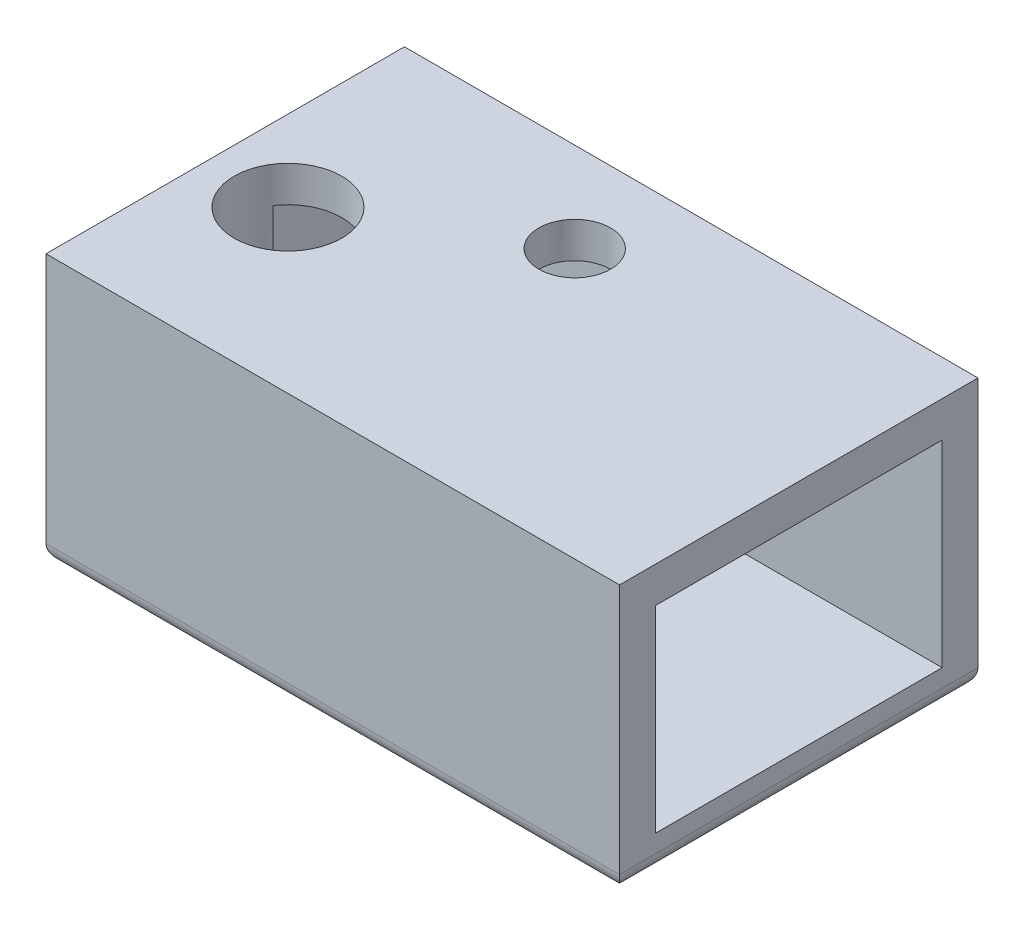
from build123d import *

# Parameters (mm, degrees)
SKETCH1_W           = 30
SKETCH1_H           = 16
BOSS_EXTRUDE1_DEPTH = 11
SHELL1_T            = 2
CUT_EXTRUDE3_REACH  = 26.779
SKETCH4_R           = 3
SKETCH4_R_2         = 2
FILLET1_R           = 1


with BuildPart() as part:
    # Sketch1 → Boss-Extrude1 (new body)
    with BuildSketch(Plane(origin=(0, 0, 0), x_dir=(1, 0, 0), z_dir=(0, 1, 0))):
        Rectangle(SKETCH1_W, SKETCH1_H)
    extrude(amount=BOSS_EXTRUDE1_DEPTH)

    # Shell1
    shell1_openings = [part.faces().sort_by_distance(p)[0] for p in [
        (15, 5.5, 0),
    ]]
    offset(amount=SHELL1_T, openings=shell1_openings, kind=Kind.INTERSECTION)

    # Cut-Extrude3: up to this face of the body (flat: up to its plane)
    cut_extrude3_end = Plane(part.part.faces().sort_by_distance((0, 0, 0))[0])
    # Sketch4 → Cut-Extrude3 (cut, up to the picked face)
    with BuildSketch(Plane(origin=(0, 13, 0), x_dir=(1, 0, 0), z_dir=(0, 1, 0)), mode=Mode.PRIVATE) as cut_extrude3_sk1:
        with Locations(Location((-12.5, -1, 0), (0, 0, 270))):
            Circle(SKETCH4_R)
    cut_extrude3_tool1 = split(extrude(cut_extrude3_sk1.sketch, amount=-CUT_EXTRUDE3_REACH, mode=Mode.PRIVATE), bisect_by=cut_extrude3_end, keep=Keep.BOTH, mode=Mode.PRIVATE)
    # Sketch4 → Cut-Extrude3 (cut, up to the picked face)
    with BuildSketch(Plane(origin=(0, 13, 0), x_dir=(1, 0, 0), z_dir=(0, 1, 0)), mode=Mode.PRIVATE) as cut_extrude3_sk2:
        with Locations(Location((-2.5, 5, 0), (0, 0, 270))):
            Circle(SKETCH4_R_2)
    cut_extrude3_tool2 = split(extrude(cut_extrude3_sk2.sketch, amount=-CUT_EXTRUDE3_REACH, mode=Mode.PRIVATE), bisect_by=cut_extrude3_end, keep=Keep.BOTH, mode=Mode.PRIVATE)
    add(cut_extrude3_tool1.solids().sort_by(Axis((-12.5, 13, 1), (0, -1, 0)))[0], mode=Mode.SUBTRACT)
    add(cut_extrude3_tool2.solids().sort_by(Axis((-2.5, 13, -5), (0, -1, 0)))[0], mode=Mode.SUBTRACT)

    # Fillet1
    fillet1_edges = [part.edges().sort_by_distance(p)[0] for p in [
        (-1, -2, 10),
        (-17, -2, 0),
        (-1, -2, -10),
        (15, -2, 0),
    ]]
    fillet(fillet1_edges, radius=FILLET1_R)


solid = part.part
